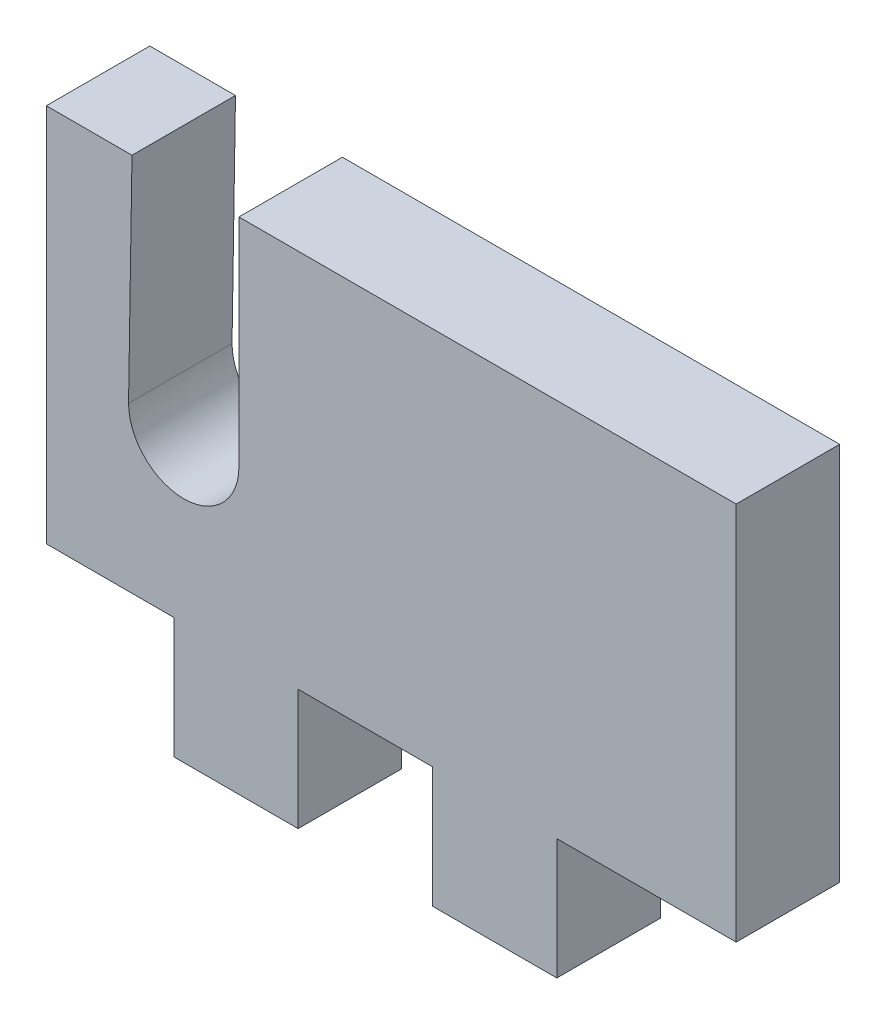
from build123d import *

# Parameters (mm, degrees)
SKETCH1_W           = 20
SKETCH1_H           = 14.5
BOSS_EXTRUDE1_DEPTH = 3
SKETCH2_W           = 3.7
SKETCH2_H           = 3.5
SKETCH2_W_2         = 3.9
SKETCH2_W_3         = 5.2
CUT_EXTRUDE1_DEPTH  = 3
CUT_EXTRUDE2_DEPTH  = 3
CUT_EXTRUDE3_DEPTH  = 3


with BuildPart() as part:
    # Sketch1 → Boss-Extrude1 (new body)
    with BuildSketch(Plane.XY):
        with Locations((2.116182573, -2.915975104)):
            Rectangle(SKETCH1_W, SKETCH1_H)
    extrude(amount=BOSS_EXTRUDE1_DEPTH)

    # Sketch2 → Cut-Extrude1 (cut)
    with BuildSketch(Plane.XY.offset(3)):
        with Locations((-6.033817427, -8.415975104)):
            Rectangle(SKETCH2_W, SKETCH2_H)
        with Locations((1.366182573, -8.415975104)):
            Rectangle(SKETCH2_W_2, SKETCH2_H)
        with Locations((9.516182573, -8.415975104)):
            Rectangle(SKETCH2_W_3, SKETCH2_H)
    extrude(amount=-CUT_EXTRUDE1_DEPTH, mode=Mode.SUBTRACT)

    # Sketch3 → Cut-Extrude2 (cut)
    with BuildSketch(Plane.XY.offset(3)):
        with BuildLine():
            Line((-2.300101836, 4.334024896), (-2.300101836, -1.938179145))
            ThreePointArc((-2.300101836, -1.938179145), (-3.850101836, -3.488179145), (-5.400101836, -1.938179145))
            Line((-5.400101836, -1.938179145), (-5.400101836, 4.334024896))
            ThreePointArc((-5.400101836, 4.334024896), (-3.850101836, 5.884024896), (-2.300101836, 4.334024896))
        make_face()
    extrude(amount=-CUT_EXTRUDE2_DEPTH, mode=Mode.SUBTRACT)

    # Sketch4 → Cut-Extrude3 (cut)
    with BuildSketch(Plane.XY.offset(3)):
        with BuildLine():
            Line((-5.400101836, 4.334024896), (-5.500101836, -1.945141671))
            ThreePointArc((-5.500101836, -1.945141671), (-3.896620573, -3.541660408), (-2.300101836, -1.938179145))
            Line((-2.300101836, -1.938179145), (-5.400101836, 4.334024896))
        make_face()
    extrude(amount=-CUT_EXTRUDE3_DEPTH, mode=Mode.SUBTRACT)


solid = part.part
